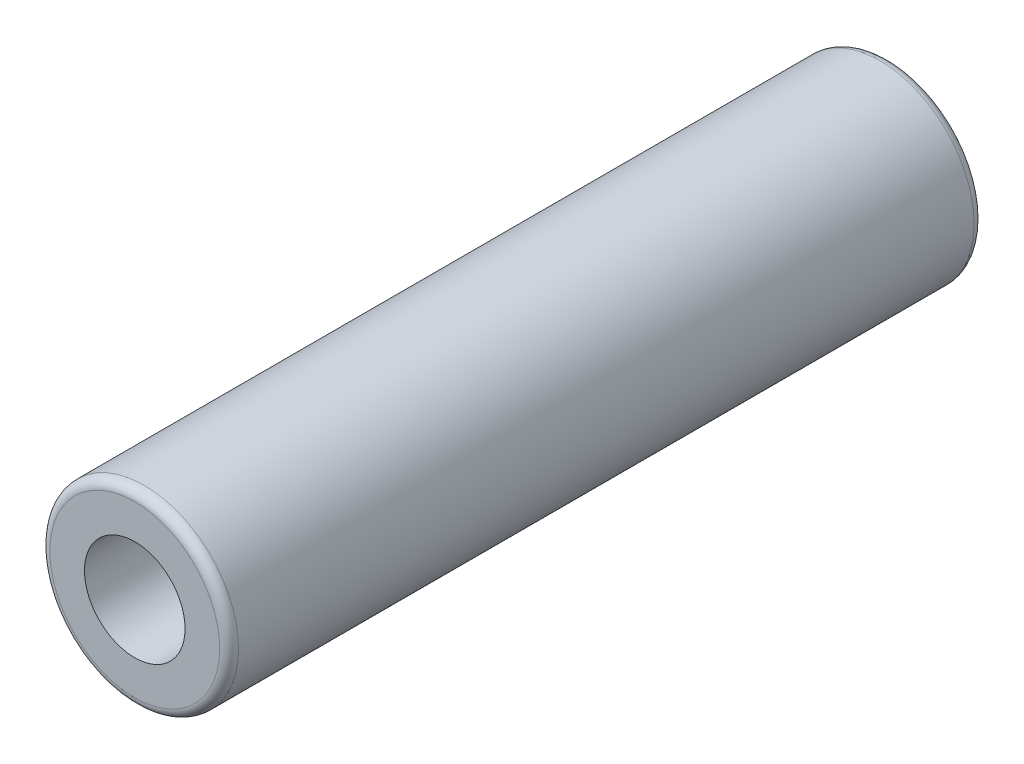
from build123d import *

# Parameters (mm, degrees)
SKETCH1_R           = 3
SKETCH1_R_2         = 1.6
BOSS_EXTRUDE1_DEPTH = 24
FILLET1_R           = 0.3


with BuildPart() as part:
    # Sketch1 → Boss-Extrude1 (new body)
    with BuildSketch(Plane.XY):
        Circle(SKETCH1_R)
        Circle(SKETCH1_R_2, mode=Mode.SUBTRACT)
    extrude(amount=BOSS_EXTRUDE1_DEPTH)

    # Fillet1
    fillet1_edges = [part.edges().sort_by_distance(p)[0] for p in [
        (-3, 0, 0),
        (-3, 0, 24),
    ]]
    fillet(fillet1_edges, radius=FILLET1_R)


solid = part.part
